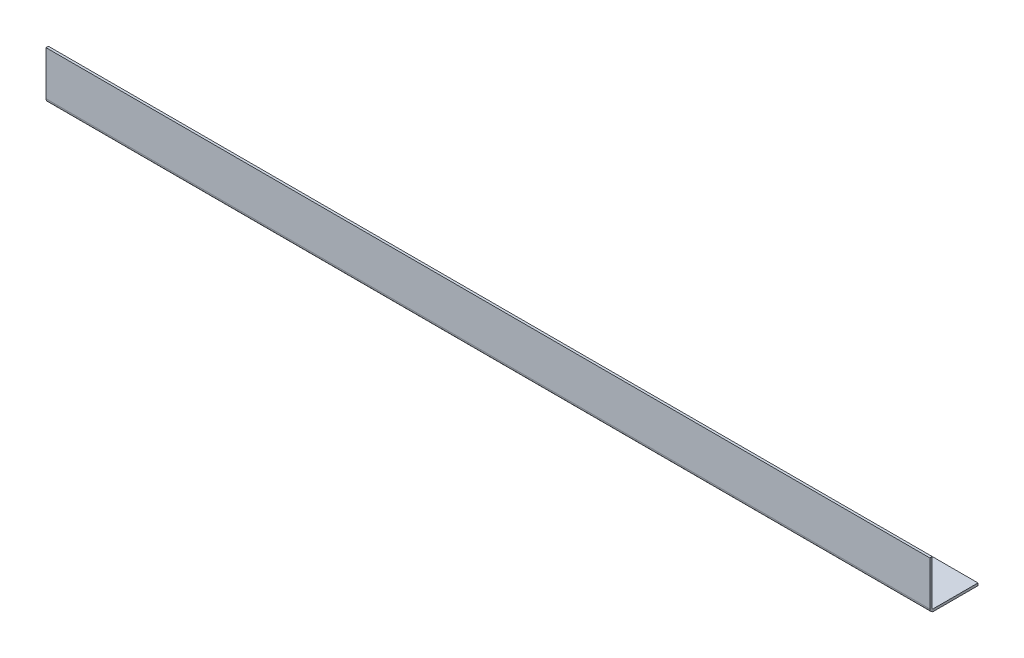
from build123d import *

# Parameters (mm, degrees)
BOSS_EXTRUDE1_DEPTH = 550
FILLET1_R           = 5
FILLET2_R           = 1


with BuildPart() as part:
    # Sketch1 → Boss-Extrude1 (new, symmetric)
    with BuildSketch(Plane(origin=(0, 0, 0), x_dir=(0, 0, -1), z_dir=(1, 0, 0))):
        Polygon((0, 0), (0, 60), (3, 60), (3, 3), (60, 3), (60, 0), align=None)
    extrude(amount=BOSS_EXTRUDE1_DEPTH, both=True)

    # Fillet1
    fillet1_edges = [part.edges().sort_by_distance(p)[0] for p in [
        (0, 0, 0),
    ]]
    fillet(fillet1_edges, radius=FILLET1_R)

    # Fillet2
    fillet2_edges = [part.edges().sort_by_distance(p)[0] for p in [
        (0, 3, -3),
    ]]
    fillet(fillet2_edges, radius=FILLET2_R)


solid = part.part
